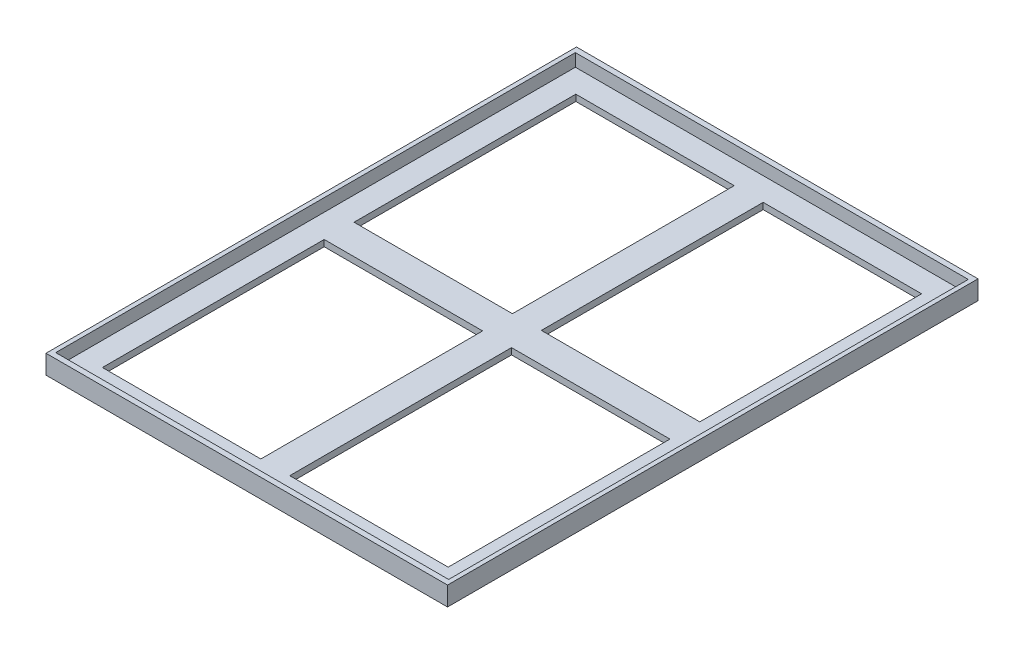
from build123d import *

# Parameters (mm, degrees)
CROQUIS1_W              = 620
CROQUIS1_H              = 820
SALIENTE_EXTRUIR1_DEPTH = 10
CROQUIS2_W              = 633.624968344
CROQUIS2_H              = 837.075812624
CROQUIS2_W_2            = 620
CROQUIS2_H_2            = 820
SALIENTE_EXTRUIR2_DEPTH = 20
CROQUIS3_W              = 633.624968344
CROQUIS3_H              = 837.075812624
SALIENTE_EXTRUIR3_DEPTH = 10
CROQUIS4_W              = 250
CROQUIS4_H              = 350
CORTAR_EXTRUIR1_DEPTH   = 10


with BuildPart() as part:
    # Croquis1 → Saliente-Extruir1 (new body)
    with BuildSketch(Plane(origin=(0, 0, 0), x_dir=(1, 0, 0), z_dir=(0, 1, 0))):
        Rectangle(CROQUIS1_W, CROQUIS1_H)
    extrude(amount=SALIENTE_EXTRUIR1_DEPTH)



with BuildPart() as body_2:
    # Croquis2 → Saliente-Extruir2 (new body)
    with BuildSketch(Plane(origin=(0, 10, 0), x_dir=(1, 0, 0), z_dir=(0, 1, 0))):
        Rectangle(CROQUIS2_W, CROQUIS2_H)
        Rectangle(CROQUIS2_W_2, CROQUIS2_H_2, mode=Mode.SUBTRACT)
    extrude(amount=SALIENTE_EXTRUIR2_DEPTH)


with BuildPart() as part_1:
    add(part.part)

    add(body_2.part)  # Saliente-Extruir3 merges body 2
    # Croquis3 → Saliente-Extruir3 (add)
    with BuildSketch(Plane.XZ.offset(-10)):
        Rectangle(CROQUIS3_W, CROQUIS3_H)
    extrude(amount=SALIENTE_EXTRUIR3_DEPTH)

    # Croquis4 → Cortar-Extruir1 (cut)
    with BuildSketch(Plane.XZ):
        with Locations((-147.812484172, 198.537906312)):
            Rectangle(CROQUIS4_W, CROQUIS4_H)
        with Locations((147.812484172, 198.537906312)):
            Rectangle(CROQUIS4_W, CROQUIS4_H)
        with Locations((-147.812484172, -198.537906312)):
            Rectangle(CROQUIS4_W, CROQUIS4_H)
        with Locations((147.812484172, -198.537906312)):
            Rectangle(CROQUIS4_W, CROQUIS4_H)
    extrude(amount=-CORTAR_EXTRUIR1_DEPTH, mode=Mode.SUBTRACT)


solid = part_1.part
